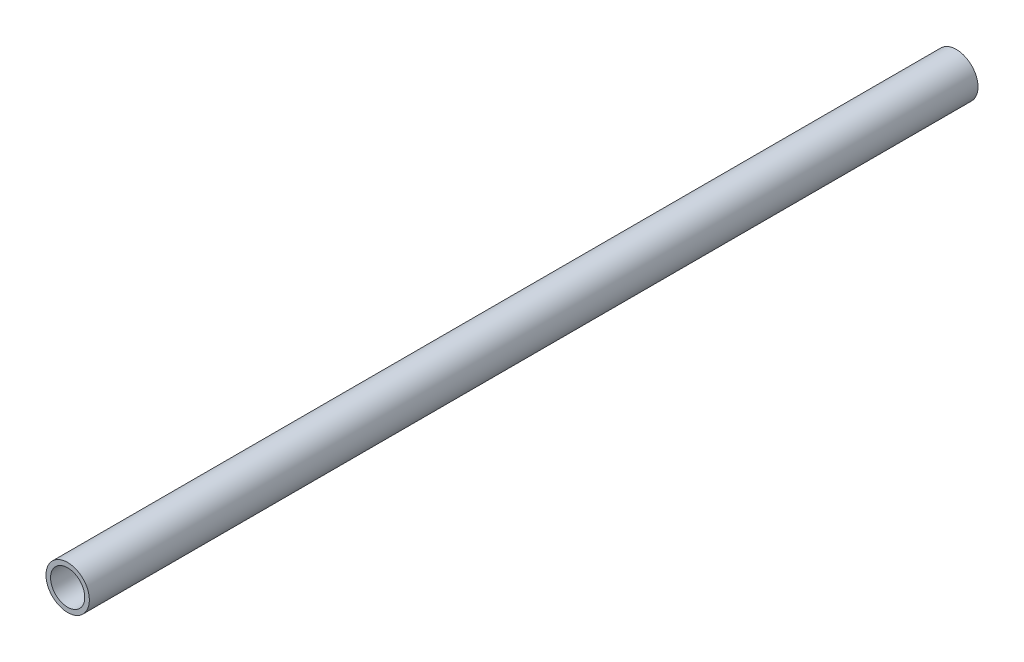
from build123d import *

# Parameters (mm, degrees)
SKETCH1_R           = 3.175
SKETCH1_R_2         = 2.5
BOSS_EXTRUDE1_DEPTH = 130


with BuildPart() as part:
    # Sketch1 → Boss-Extrude1 (new body)
    with BuildSketch(Plane.XY):
        Circle(SKETCH1_R)
        Circle(SKETCH1_R_2, mode=Mode.SUBTRACT)
    extrude(amount=BOSS_EXTRUDE1_DEPTH)


solid = part.part
